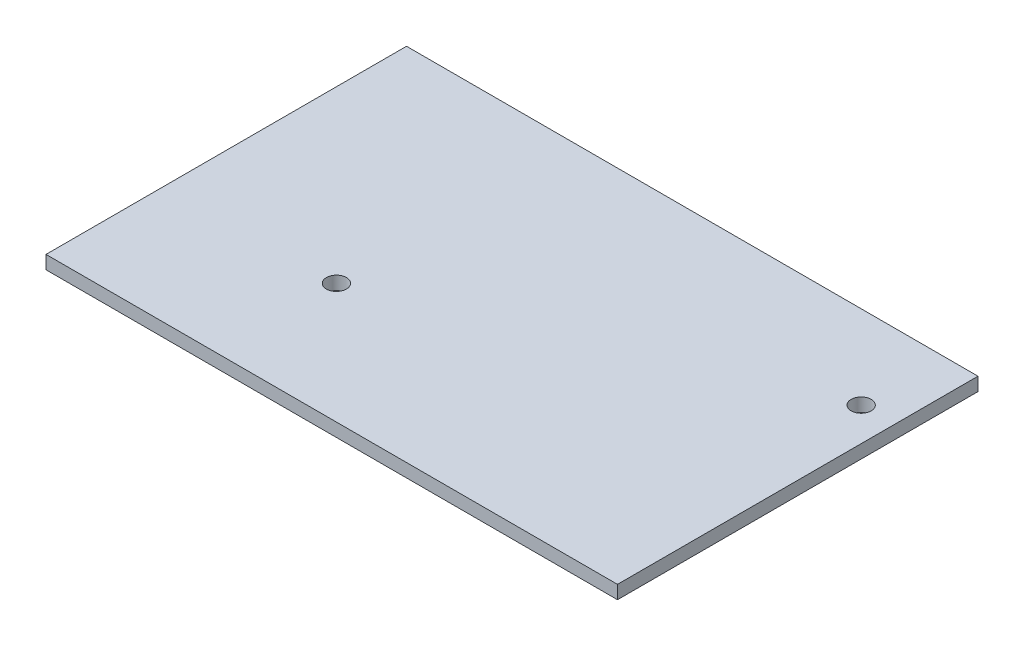
from build123d import *

# Parameters (mm, degrees)
SKETCH1_W           = 85.6
SKETCH1_H           = 54
SKETCH1_R           = 1.5
BOSS_EXTRUDE1_DEPTH = 2


with BuildPart() as part:
    # Sketch1 → Boss-Extrude1 (new body)
    with BuildSketch(Plane(origin=(0, 0, 0), x_dir=(1, 0, 0), z_dir=(0, 1, 0))):
        with Locations((-93.388679245, 34.641509434)):
            Rectangle(SKETCH1_W, SKETCH1_H)
        with Locations(Location((-110.688679245, 25.641509434, 0), (0, 0, 270))):
            Circle(SKETCH1_R, mode=Mode.SUBTRACT)
        with Locations(Location((-55.588679245, 49.141509434, 0), (0, 0, 270))):
            Circle(SKETCH1_R, mode=Mode.SUBTRACT)
    extrude(amount=BOSS_EXTRUDE1_DEPTH)


solid = part.part
